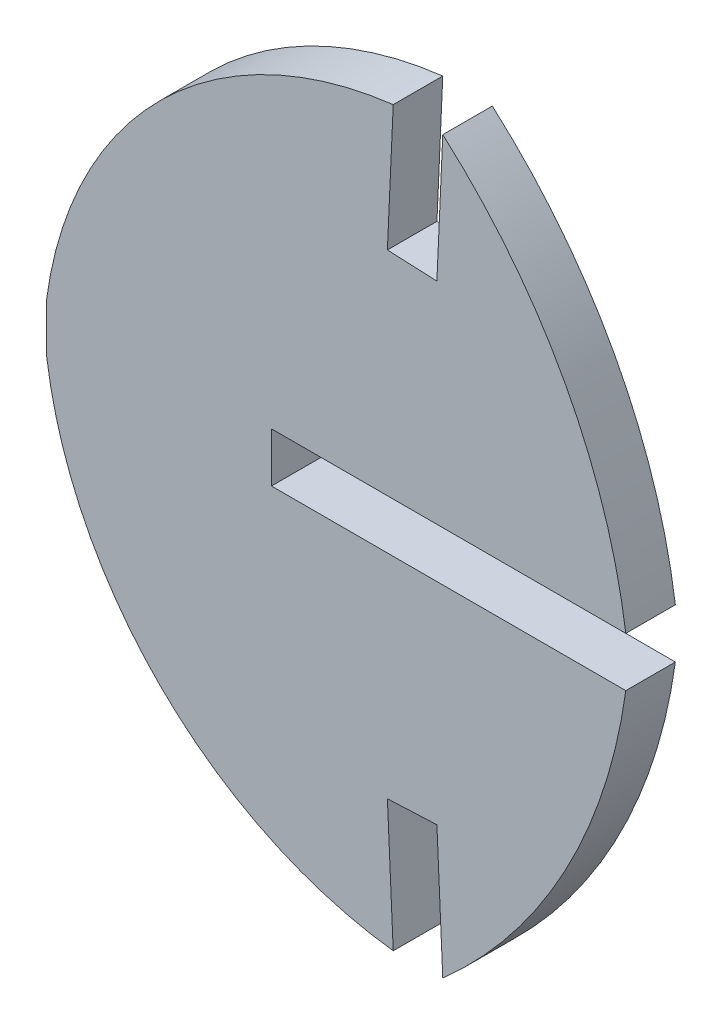
from build123d import *

# Parameters (mm, degrees)
BOSS_EXTRUDE1_DEPTH = 1.524


with BuildPart() as part:
    # Sketch1 → Boss-Extrude1 (new body)
    with BuildSketch(Plane.XY):
        with BuildLine():
            Line((68.053425724, 0), (68.053425724, -1.524))
            Line((68.053425724, -1.524), (78.95165892, -1.524))
            ThreePointArc((78.95165892, -1.524), (77.077407117, -7.264754764), (73.322018867, -11.994040562))
            Line((73.322018867, -11.994040562), (73.141160104, -8.002049555))
            Line((73.141160104, -8.002049555), (71.618721766, -8.071024238))
            Line((71.618721766, -8.071024238), (71.798167573, -12.031827879))
            ThreePointArc((71.798167573, -12.031827879), (64.673060187, -8.599062053), (61.138299457, -1.524))
            Line((61.138299457, -1.524), (61.138299457, 0))
            ThreePointArc((61.138299457, 0), (64.673060187, 7.075062053), (71.798167573, 10.507827879))
            Line((71.798167573, 10.507827879), (71.618721766, 6.547024238))
            Line((71.618721766, 6.547024238), (73.141160104, 6.478049555))
            Line((73.141160104, 6.478049555), (73.322018867, 10.470040562))
            ThreePointArc((73.322018867, 10.470040562), (77.077407117, 5.740754764), (78.95165892, 0))
            Line((78.95165892, 0), (68.053425724, 0))
        make_face()
    extrude(amount=BOSS_EXTRUDE1_DEPTH)


solid = part.part
